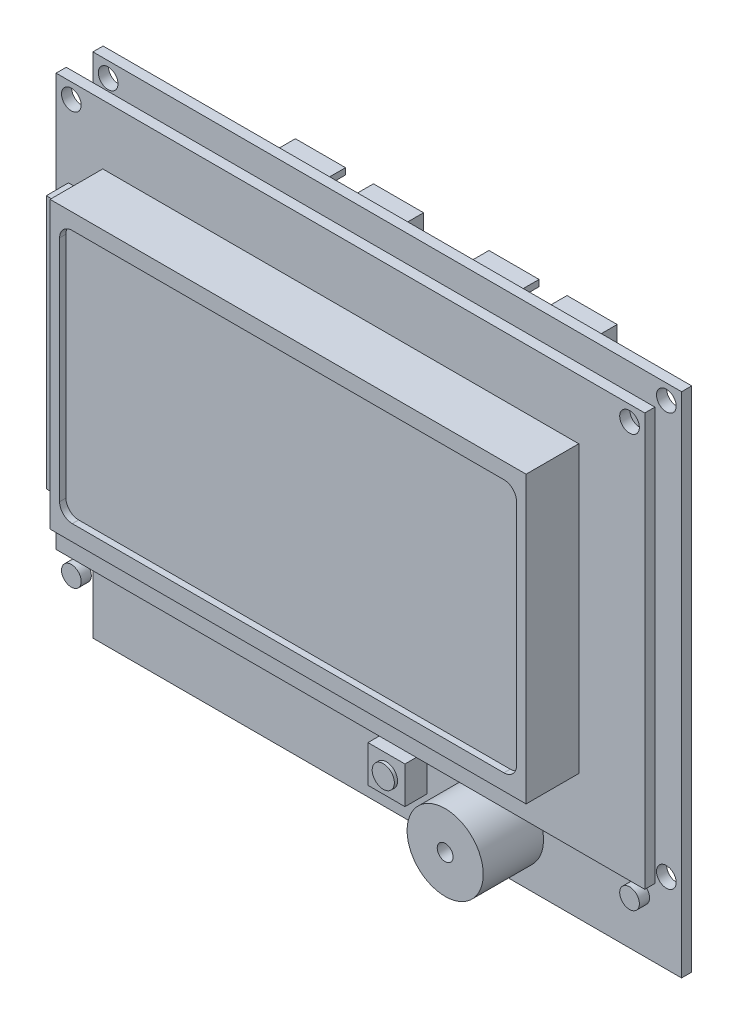
from build123d import *

# Parameters (mm, degrees)
SKETCH1_W                             = 92.75
SKETCH1_H                             = 80
SKETCH1_R                             = 1.55
BOSS_EXTRUDE1_FIRST_PCB_DEPTH         = 1.6
SKETCH2_R                             = 6
BOSS_EXTRUDE2_SPEAKER_DEPTH           = 9.5
SKETCH15_R                            = 1.25
CUT_EXTRUDE1_SPEAKER_HOLE_DEPTH       = 5
SKETCH4_W                             = 5.83
SKETCH4_H                             = 5.83
BOSS_EXTRUDE4_RESET_SWITCH_DEPTH      = 3.5
SKETCH5_R                             = 1.75
BOSS_EXTRUDE5_RESET_BUTTON_DEPTH      = 0.5
SKETCH19_W                            = 50
SKETCH19_H                            = 2.5
BOSS_EXTRUDE10_CONNECTOR_DEPTH        = 4.2
SKETCH11_R                            = 1.55
SKETCH11_W                            = 92.75
SKETCH11_H                            = 65
BOSS_EXTRUDE11_UPPER_PCB_DEPTH        = 1.6
SKETCH12_W                            = 75
SKETCH12_H                            = 45
BOSS_EXTRUDE12_LCD_DEPTH              = 8.3
SKETCH24_W                            = 5.4
SKETCH24_H                            = 40
BOSS_EXTRUDE13_LCD_BUMPOUT_DEPTH      = 3.5
CUT_EXTRUDE2_SCREEN_RECESS_DEPTH      = 1
SKETCH21_W                            = 20.2
SKETCH21_H                            = 8.85
SKETCH21_W_2                          = 18.2
SKETCH21_H_2                          = 6.85
BOSS_EXTRUDE14_CONNECTORS_DEPTH       = 9
SKETCH22_W                            = 18.2
SKETCH22_H                            = 6.85
BOSS_EXTRUDE15_CONNECTOR_RECESS_DEPTH = 2.55
SKETCH23_W                            = 4.4
SKETCH23_H                            = 1
CUT_EXTRUDE3_CONNECTOR_NOTCH_DEPTH    = 6.45


with BuildPart() as part:
    # Sketch1 → Boss-Extrude1 - First PCB (new body)
    with BuildSketch(Plane.XY):
        Rectangle(SKETCH1_W, SKETCH1_H)
        with Locations((-43.975, 37.6)):
            Circle(SKETCH1_R, mode=Mode.SUBTRACT)
        with Locations(Location((43.975, 37.6, 0), (0, 0, 180))):
            Circle(SKETCH1_R, mode=Mode.SUBTRACT)
        with Locations((43.975, -27.4)):
            Circle(SKETCH1_R, mode=Mode.SUBTRACT)
        with Locations(Location((-43.975, -27.4, 0), (0, 0, 180))):
            Circle(SKETCH1_R, mode=Mode.SUBTRACT)
    extrude(amount=BOSS_EXTRUDE1_FIRST_PCB_DEPTH)

    # Sketch2 → Boss-Extrude2 - Speaker (add)
    with BuildSketch(Plane.XY.offset(1.6)):
        with Locations(Location((18.625, -32, 0), (0, 0, 180))):
            Circle(SKETCH2_R)
    extrude(amount=BOSS_EXTRUDE2_SPEAKER_DEPTH)

    # Sketch15 → Cut-Extrude1 - Speaker Hole (cut)
    with BuildSketch(Plane.XY.offset(11.1)):
        with Locations((18.625, -32)):
            Circle(SKETCH15_R)
    extrude(amount=-CUT_EXTRUDE1_SPEAKER_HOLE_DEPTH, mode=Mode.SUBTRACT)

    # Sketch4 → Boss-Extrude4 - Reset Switch (add)
    with BuildSketch(Plane(origin=(0, 0, 1.6), x_dir=(-1, 0, 0), z_dir=(0, 0, 1))):
        with Locations((-3.375, 32)):
            Rectangle(SKETCH4_W, SKETCH4_H)
    extrude(amount=BOSS_EXTRUDE4_RESET_SWITCH_DEPTH)

    # Sketch5 → Boss-Extrude5 - Reset Button (add)
    with BuildSketch(Plane(origin=(0, 0, 5.1), x_dir=(-1, 0, 0), z_dir=(0, 0, 1))):
        with Locations(Location((-3.375, 32, 0), (0, 0, 180))):
            Circle(SKETCH5_R)
    extrude(amount=BOSS_EXTRUDE5_RESET_BUTTON_DEPTH)

    # Sketch19 → Boss-Extrude10 - Connector (add)
    with BuildSketch(Plane.XY.offset(1.6)):
        with Locations((-8.375, -20.75)):
            Rectangle(SKETCH19_W, SKETCH19_H)
    extrude(amount=BOSS_EXTRUDE10_CONNECTOR_DEPTH)

    # Sketch11 → Boss-Extrude11 - Upper PCB (add)
    # profile 1 of 3: a face of its own
    with BuildSketch(Plane(origin=(0, -2, 5.8), x_dir=(1, 0, 0), z_dir=(0, 0, -1))):
        with Locations(Location((-43.975, 25.4, 0), (0, 0, 180))):
            Circle(SKETCH11_R)
    # profile 2 of 3: a face of its own
    with BuildSketch(Plane(origin=(0, -2, 5.8), x_dir=(1, 0, 0), z_dir=(0, 0, -1))):
        with Locations(Location((43.975, 25.4, 0), (0, 0, 180))):
            Circle(SKETCH11_R)
    # profile 3 of 3: a face of its own
    with BuildSketch(Plane(origin=(0, -2, 5.8), x_dir=(1, 0, 0), z_dir=(0, 0, -1))):
        with Locations((0, -9.5)):
            Rectangle(SKETCH11_W, SKETCH11_H)
        with Locations((-43.975, -39.6)):
            Circle(SKETCH11_R, mode=Mode.SUBTRACT)
        with Locations(Location((43.975, -39.6, 0), (0, 0, 180))):
            Circle(SKETCH11_R, mode=Mode.SUBTRACT)
    extrude(amount=-BOSS_EXTRUDE11_UPPER_PCB_DEPTH)


with BuildPart() as boss_extrude11_upper_pcb_piece_1:
    # of the separate pieces the step leaves, piece 1, a body of its own (boss_extrude11_upper_pcb_pieces)
    add(part.part.solids().sort_by_distance((46.375, -25, 5.8))[0])

    # Sketch12 → Boss-Extrude12 - LCD (add)
    with BuildSketch(Plane(origin=(0, 0, 7.4), x_dir=(-1, 0, 0), z_dir=(0, 0, 1))):
        with Locations((1.525, -8.1)):
            Rectangle(SKETCH12_W, SKETCH12_H)
    extrude(amount=BOSS_EXTRUDE12_LCD_DEPTH)

    # Sketch24 → Boss-Extrude13 - LCD Bumpout (add)
    with BuildSketch(Plane.XY.offset(7.4)):
        with Locations((-41.725, 6)):
            Rectangle(SKETCH24_W, SKETCH24_H)
    extrude(amount=BOSS_EXTRUDE13_LCD_BUMPOUT_DEPTH)

    # Sketch13 → Cut-Extrude2 - Screen Recess (cut)
    with BuildSketch(Plane(origin=(0, 0, 15.7), x_dir=(-1, 0, 0), z_dir=(0, 0, 1))):
        with BuildLine():
            Line((-32.475, 11.9), (35.525, 11.9))
            ThreePointArc((35.525, 11.9), (36.939213562, 11.314213562), (37.525, 9.9))
            Line((37.525, 9.9), (37.525, -26.1))
            ThreePointArc((37.525, -26.1), (36.939213562, -27.514213562), (35.525, -28.1))
            Line((35.525, -28.1), (-32.475, -28.1))
            ThreePointArc((-32.475, -28.1), (-33.889213562, -27.514213562), (-34.475, -26.1))
            Line((-34.475, -26.1), (-34.475, 9.9))
            ThreePointArc((-34.475, 9.9), (-33.889213562, 11.314213562), (-32.475, 11.9))
        make_face()
    extrude(amount=-CUT_EXTRUDE2_SCREEN_RECESS_DEPTH, mode=Mode.SUBTRACT)

    # Sketch21 → Boss-Extrude14 - Connectors (add)
    # profile 1 of 2: a face of its own
    with BuildSketch(Plane(origin=(0, 0, 0), x_dir=(-1, 0, 0), z_dir=(0, 0, -1))):
        with Locations((-15.525, 29.075)):
            Rectangle(SKETCH21_W, SKETCH21_H)
        with Locations((-15.525, 29.075)):
            Rectangle(SKETCH21_W_2, SKETCH21_H_2, mode=Mode.SUBTRACT)
    # profile 2 of 2: a face of its own
    with BuildSketch(Plane(origin=(0, 0, 0), x_dir=(-1, 0, 0), z_dir=(0, 0, -1))):
        with Locations((14.975, 29.075)):
            Rectangle(SKETCH21_W, SKETCH21_H)
        with Locations((14.975, 29.075)):
            Rectangle(SKETCH21_W_2, SKETCH21_H_2, mode=Mode.SUBTRACT)
    extrude(amount=BOSS_EXTRUDE14_CONNECTORS_DEPTH)

    # Sketch22 → Boss-Extrude15 - Connector Recess (add)
    with BuildSketch(Plane(origin=(0, 0, 0), x_dir=(-1, 0, 0), z_dir=(0, 0, -1))):
        with Locations((-15.525, 29.075)):
            Rectangle(SKETCH22_W, SKETCH22_H)
        with Locations((14.975, 29.075)):
            Rectangle(SKETCH22_W, SKETCH22_H)
    extrude(amount=BOSS_EXTRUDE15_CONNECTOR_RECESS_DEPTH)

    # Sketch23 → Cut-Extrude3 - Connector Notch (cut)
    with BuildSketch(Plane(origin=(0, 0, -9), x_dir=(-1, 0, 0), z_dir=(0, 0, -1))):
        with Locations((-15.525, 33)):
            Rectangle(SKETCH23_W, SKETCH23_H)
        with Locations((14.975, 33)):
            Rectangle(SKETCH23_W, SKETCH23_H)
    extrude(amount=-CUT_EXTRUDE3_CONNECTOR_NOTCH_DEPTH, mode=Mode.SUBTRACT)


with BuildPart() as boss_extrude11_upper_pcb_piece_2:
    # of the separate pieces the step leaves, piece 2, a body of its own (boss_extrude11_upper_pcb_pieces)
    add(part.part.solids().sort_by_distance((-45.525, -27.4, 5.8))[0])


with BuildPart() as boss_extrude11_upper_pcb_piece_3:
    # of the separate pieces the step leaves, piece 3, a body of its own (boss_extrude11_upper_pcb_pieces)
    add(part.part.solids().sort_by_distance((42.425, -27.4, 5.8))[0])


solid = Compound([boss_extrude11_upper_pcb_piece_1.part, boss_extrude11_upper_pcb_piece_2.part, boss_extrude11_upper_pcb_piece_3.part])
